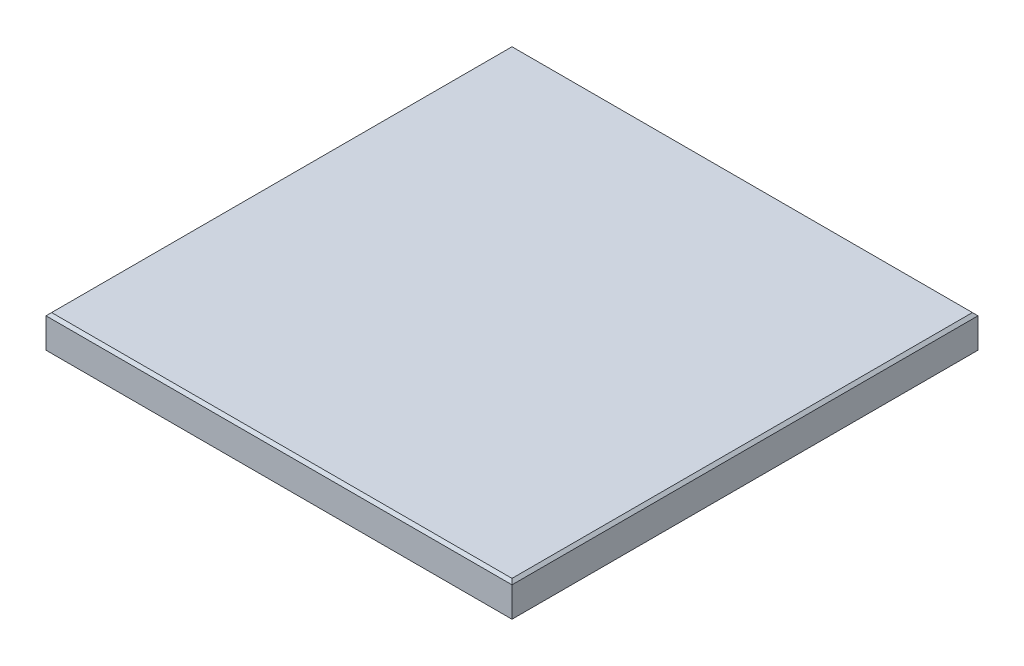
from build123d import *

# Parameters (mm, degrees)
SKETCH1_W           = 127
SKETCH1_H           = 127
BOSS_EXTRUDE1_DEPTH = 15.24
SKETCH2_W           = 127
SKETCH2_H           = 127
SKETCH2_W_2         = 100.33
SKETCH2_H_2         = 100.33
CUT_EXTRUDE1_DEPTH  = 6.35
FILLET1_R           = 0.762
CHAMFER1_SIZE       = 0.762


with BuildPart() as part:
    # Sketch1 → Boss-Extrude1 (new body)
    with BuildSketch(Plane(origin=(0, 0, 0), x_dir=(1, 0, 0), z_dir=(0, 1, 0))):
        Rectangle(SKETCH1_W, SKETCH1_H)
    extrude(amount=BOSS_EXTRUDE1_DEPTH)

    # Sketch2 → Cut-Extrude1 (cut)
    with BuildSketch(Plane.XZ):
        Rectangle(SKETCH2_W, SKETCH2_H)
        Rectangle(SKETCH2_W_2, SKETCH2_H_2, mode=Mode.SUBTRACT)
    extrude(amount=-CUT_EXTRUDE1_DEPTH, mode=Mode.SUBTRACT)

    # Fillet1
    fillet1_edges = [part.edges().sort_by_distance(p)[0] for p in [
        (-50.165, 3.175, -50.165),
        (-50.165, 3.175, 50.165),
        (50.165, 3.175, 50.165),
        (50.165, 3.175, -50.165),
    ]]
    fillet(fillet1_edges, radius=FILLET1_R)

    # Chamfer1
    chamfer1_edges = [part.edges().sort_by_distance(p)[0] for p in [
        (-63.5, 15.24, 0),
        (0, 15.24, 63.5),
        (63.5, 15.24, 0),
        (0, 15.24, -63.5),
    ]]
    chamfer(chamfer1_edges, length=CHAMFER1_SIZE)


solid = part.part
